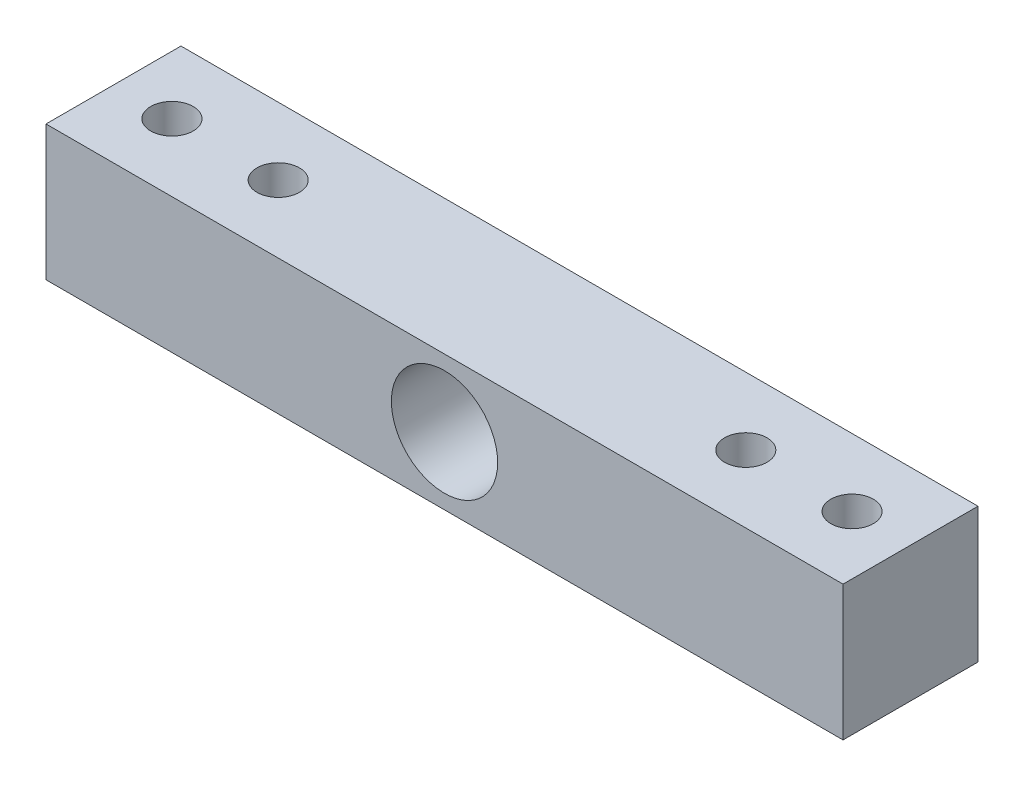
from build123d import *

# Parameters (mm, degrees)
SKETCH1_W           = 75
SKETCH1_H           = 12.7
BOSS_EXTRUDE2_DEPTH = 12.7
SKETCH2_R           = 2
CUT_EXTRUDE1_DEPTH  = 175.598479387
SKETCH3_R           = 5
CUT_EXTRUDE2_DEPTH  = 135.940675175


with BuildPart() as part:
    # Sketch1 → Boss-Extrude2 (new body)
    with BuildSketch(Plane(origin=(0, 0, 0), x_dir=(1, 0, 0), z_dir=(0, 1, 0))):
        with Locations((96.240068104, 105.170998865)):
            Rectangle(SKETCH1_W, SKETCH1_H)
    extrude(amount=BOSS_EXTRUDE2_DEPTH)

    # Sketch2 → Cut-Extrude1 (cut, through all)
    with BuildSketch(Plane(origin=(0, 12.7, 0), x_dir=(1, 0, 0), z_dir=(0, 1, 0))):
        with Locations(Location((74.240068104, 105.170998865, 0), (0, 0, 270))):
            Circle(SKETCH2_R)
        with Locations(Location((64.240068104, 105.170998865, 0), (0, 0, 270))):
            Circle(SKETCH2_R)
        with Locations(Location((118.240068104, 105.170998865, 0), (0, 0, 270))):
            Circle(SKETCH2_R)
        with Locations(Location((128.240068104, 105.170998865, 0), (0, 0, 270))):
            Circle(SKETCH2_R)
    extrude(amount=-CUT_EXTRUDE1_DEPTH, mode=Mode.SUBTRACT)

    # Sketch3 → Cut-Extrude2 (cut, through all)
    with BuildSketch(Plane.XY.offset(-98.820998865)):
        with Locations((96.240068104, 6.35)):
            Circle(SKETCH3_R)
    extrude(amount=-CUT_EXTRUDE2_DEPTH, mode=Mode.SUBTRACT)


solid = part.part
